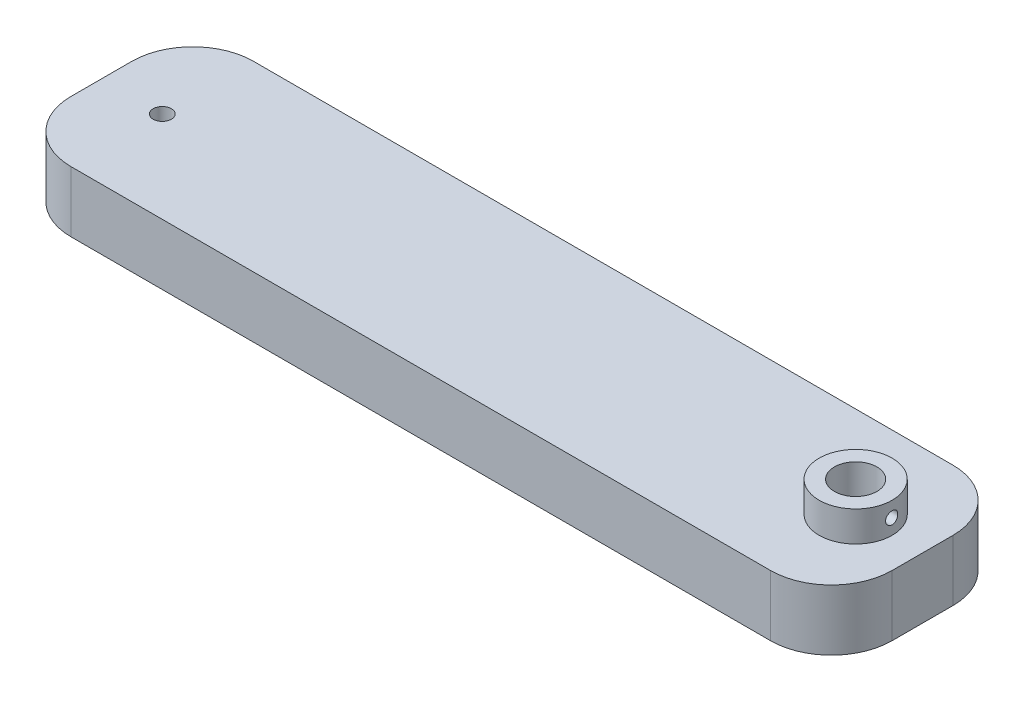
from build123d import *

# Parameters (mm, degrees)
CROQUIS1_W              = 135
CROQUIS1_H              = 30
SALIENTE_EXTRUIR1_DEPTH = 10
REDONDEO3_R             = 10
CROQUIS3_R              = 1.5
CROQUIS3_R_2            = 3.5
CORTAR_EXTRUIR2_DEPTH   = 10
SALIENTE_EXTRUIR2_START = 5
CROQUIS4_R              = 6
CROQUIS4_R_2            = 3.5
SALIENTE_EXTRUIR2_DEPTH = 5
CROQUIS5_R              = 1
CORTAR_EXTRUIR3_DEPTH   = 6


with BuildPart() as part:
    # Croquis1 → Saliente-Extruir1 (new body)
    with BuildSketch(Plane(origin=(0, 0, 0), x_dir=(1, 0, 0), z_dir=(0, 1, 0))):
        Rectangle(CROQUIS1_W, CROQUIS1_H)
    extrude(amount=SALIENTE_EXTRUIR1_DEPTH)

    # Redondeo3
    redondeo3_edges = [part.edges().sort_by_distance(p)[0] for p in [
        (-67.5, 5, -15),
        (67.5, 5, -15),
        (67.5, 5, 15),
        (-67.5, 5, 15),
    ]]
    fillet(redondeo3_edges, radius=REDONDEO3_R)

    # Croquis3 → Cortar-Extruir2 (cut)
    with BuildSketch(Plane(origin=(0, 10, 0), x_dir=(1, 0, 0), z_dir=(0, 1, 0))):
        with Locations(Location((-57.5, 0, 0), (0, 0, 270))):
            Circle(CROQUIS3_R)
        with Locations(Location((56.5, 0, 0), (0, 0, 270))):
            Circle(CROQUIS3_R_2)
    extrude(amount=-CORTAR_EXTRUIR2_DEPTH, mode=Mode.SUBTRACT)

    # Croquis4 → Saliente-Extruir2 (add)
    with BuildSketch(Plane(origin=(0, 10, 0), x_dir=(1, 0, 0), z_dir=(0, 1, 0)).offset(SALIENTE_EXTRUIR2_START)):
        with Locations(Location((56.5, 0, 0), (0, 0, 270))):
            Circle(CROQUIS4_R)
        with Locations(Location((56.5, 0, 0), (0, 0, 270))):
            Circle(CROQUIS4_R_2, mode=Mode.SUBTRACT)
    extrude(amount=-SALIENTE_EXTRUIR2_DEPTH)

    # Croquis5 → Cortar-Extruir3 (cut)
    with BuildSketch(Plane(origin=(56.5, 0, 0), x_dir=(0, 0, -1), z_dir=(1, 0, 0))):
        with Locations(Location((0, 12.5, 0), (0, 0, 180))):
            Circle(CROQUIS5_R)
    extrude(amount=CORTAR_EXTRUIR3_DEPTH, mode=Mode.SUBTRACT)


solid = part.part
